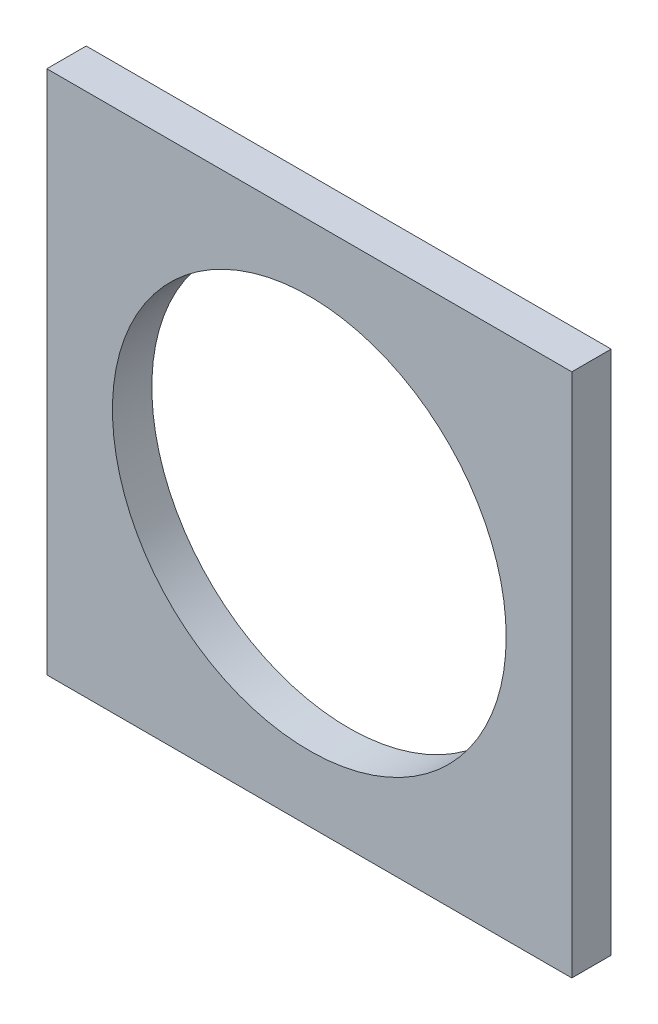
from build123d import *

# Parameters (mm, degrees)
SKETCH1_W           = 40
SKETCH1_H           = 40
SKETCH1_R           = 15
BOSS_EXTRUDE1_DEPTH = 3


with BuildPart() as part:
    # Sketch1 → Boss-Extrude1 (new body)
    with BuildSketch(Plane.XY):
        with Locations((-55, -123.411017403)):
            Rectangle(SKETCH1_W, SKETCH1_H)
        with Locations((-55, -123.411017403)):
            Circle(SKETCH1_R, mode=Mode.SUBTRACT)
    extrude(amount=BOSS_EXTRUDE1_DEPTH)


solid = part.part
